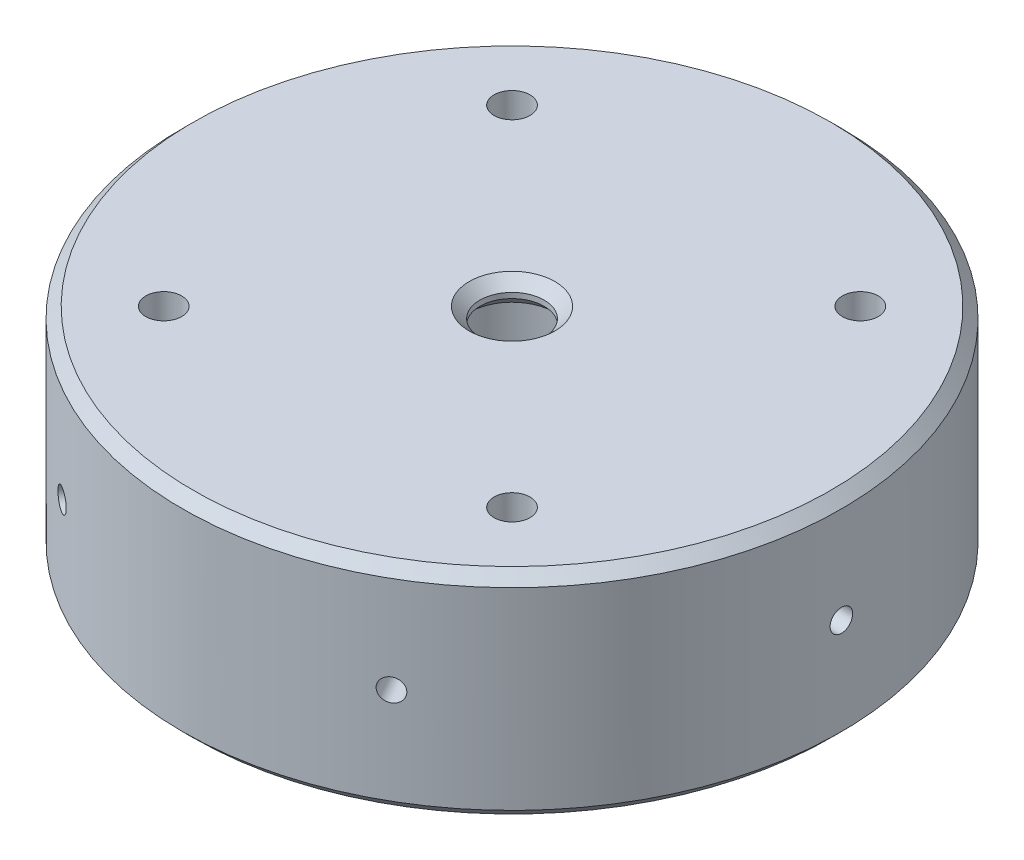
from build123d import *

# Parameters (mm, degrees)
SKETCH2_R               = 3.35
CUT_EXTRUDE1_DEPTH      = 25
CIRPATTERN1_COUNT       = 4
SKETCH5_R               = 53.5
SKETCH5_R_2             = 29
CUT_EXTRUDE4_DEPTH      = 28
CUT_EXTRUDE5_REACH      = 145.217
CUT_EXTRUDE5_END_RADIUS = 53.5
SKETCH6_R               = 2.1
CIRPATTERN2_COUNT       = 6
CHAMFER1_SIZE           = 2
FILLET2_R               = 1
FILLET3_R               = 5


with BuildPart() as part:
    # Sketch1 → Revolve1 (revolve)
    with BuildSketch(Plane(origin=(0, 0, 0), x_dir=(0, 0, -1), z_dir=(1, 0, 0)), mode=Mode.PRIVATE) as revolve1_sk:
        Polygon((-24, 0), (-61.5, 0), (-61.5, 40), (-6, 40), (-6, 35), (-13, 35), (-13, 7.5), (-24, 7.5), align=None)
    revolve(revolve1_sk.sketch.rotate(Axis((0, 0, 0), (0, 1, 0)), 180), axis=Axis((0, 0, 0), (0, 1, 0)))

    # Sketch2 → Cut-Extrude1 (cut)
    with BuildSketch(Plane(origin=(0, 40, 0), x_dir=(1, 0, 0), z_dir=(0, 1, 0))):
        with Locations(Location((-32.5, 32.5, 0), (0, 0, 270))):
            Circle(SKETCH2_R)
    cut_extrude1 = extrude(amount=-CUT_EXTRUDE1_DEPTH, mode=Mode.SUBTRACT)

    # CirPattern1: Cut-Extrude1 ×4 about axis
    cirpattern1_axis = Axis((0, 0, 0), (0, 1, 0))
    for i in range(1, CIRPATTERN1_COUNT):
        add(cut_extrude1.rotate(cirpattern1_axis, i * 360 / CIRPATTERN1_COUNT), mode=Mode.SUBTRACT)

    # Sketch5 → Cut-Extrude4 (cut)
    with BuildSketch(Plane.XZ):
        with Locations(Location((0, 0, 0), (0, 0, 270))):
            Circle(SKETCH5_R)
        with Locations(Location((0, 0, 0), (0, 0, 270))):
            Circle(SKETCH5_R_2, mode=Mode.SUBTRACT)
    extrude(amount=-CUT_EXTRUDE4_DEPTH, mode=Mode.SUBTRACT)

    # Cut-Extrude5: up to this cylinder (the profile starts outside it)
    cut_extrude5_end = Plane(origin=(0, 20, 0), z_dir=(0, -1, 0)) * Cylinder(CUT_EXTRUDE5_END_RADIUS, 398.434, mode=Mode.PRIVATE)
    # Sketch6 → Cut-Extrude5 (cut, up to the surface)
    with BuildSketch(Plane(origin=(61.5, 0, 0), x_dir=(0, 0, -1), z_dir=(1, 0, 0)), mode=Mode.PRIVATE) as cut_extrude5_sk1:
        with Locations((0, 20)):
            Circle(SKETCH6_R)
    cut_extrude5_tool1 = extrude(cut_extrude5_sk1.sketch, amount=-CUT_EXTRUDE5_REACH, mode=Mode.PRIVATE) - cut_extrude5_end
    cut_extrude5 = cut_extrude5_tool1.solids().sort_by_distance((61.5, 20, 0))[0]
    add(cut_extrude5, mode=Mode.SUBTRACT)

    # CirPattern2: Cut-Extrude5 ×6 about axis
    cirpattern2_axis = Axis((0, 40, 0), (0, -1, 0))
    for i in range(1, CIRPATTERN2_COUNT):
        add(cut_extrude5.rotate(cirpattern2_axis, i * 360 / CIRPATTERN2_COUNT), mode=Mode.SUBTRACT)

    # Chamfer1
    chamfer1_edges = [part.edges().sort_by_distance(p)[0] for p in [
        (0, 0, 24),
        (0, 0, 53.5),
        (0, 0, 29),
        (0, 7.5, 13),
        (0, 35, 6),
        (0, 40, 6),
        (0, 40, 61.5),
        (0, 0, 61.5),
    ]]
    chamfer(chamfer1_edges, length=CHAMFER1_SIZE)

    # Fillet2
    fillet2_edges = [part.edges().sort_by_distance(p)[0] for p in [
        (0, 28, 53.5),
        (0, 7.5, 24),
        (0, 35, 13),
    ]]
    fillet(fillet2_edges, radius=FILLET2_R)

    # Fillet3
    fillet3_edges = [part.edges().sort_by_distance(p)[0] for p in [
        (0, 28, 29),
    ]]
    fillet(fillet3_edges, radius=FILLET3_R)


solid = part.part
